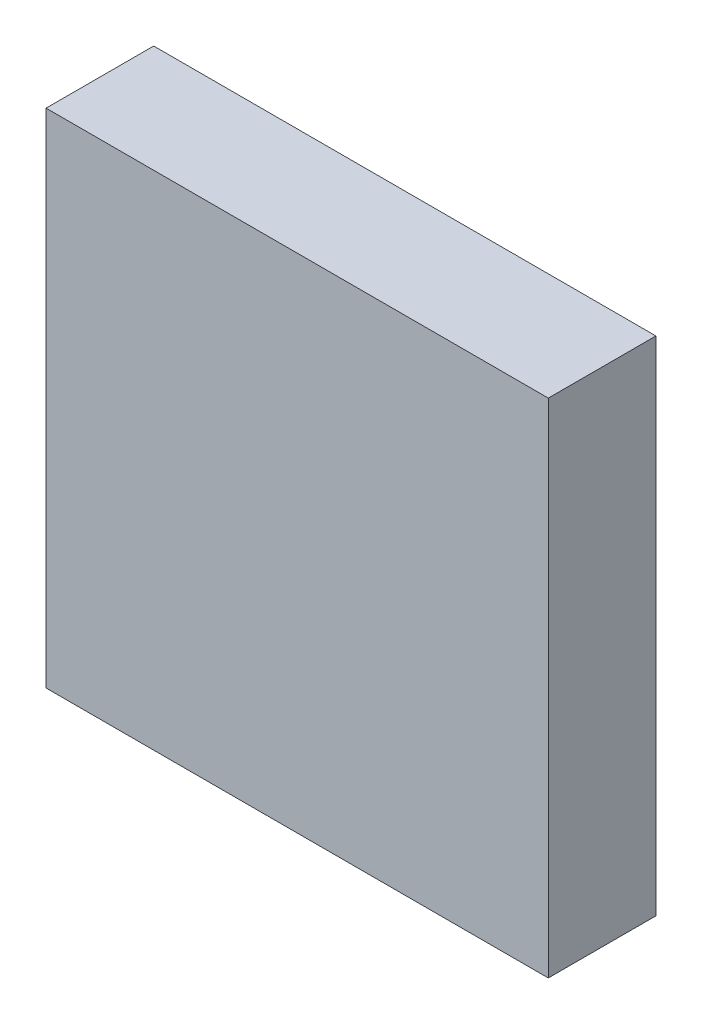
from build123d import *

# Parameters (mm, degrees)
SKETCH1_W           = 88.9
SKETCH1_H           = 88.9
BOSS_EXTRUDE1_DEPTH = 19.05


with BuildPart() as part:
    # Sketch1 → Boss-Extrude1 (new body)
    with BuildSketch(Plane.XY):
        with Locations((44.45, 44.45)):
            Rectangle(SKETCH1_W, SKETCH1_H)
    extrude(amount=BOSS_EXTRUDE1_DEPTH)


solid = part.part
